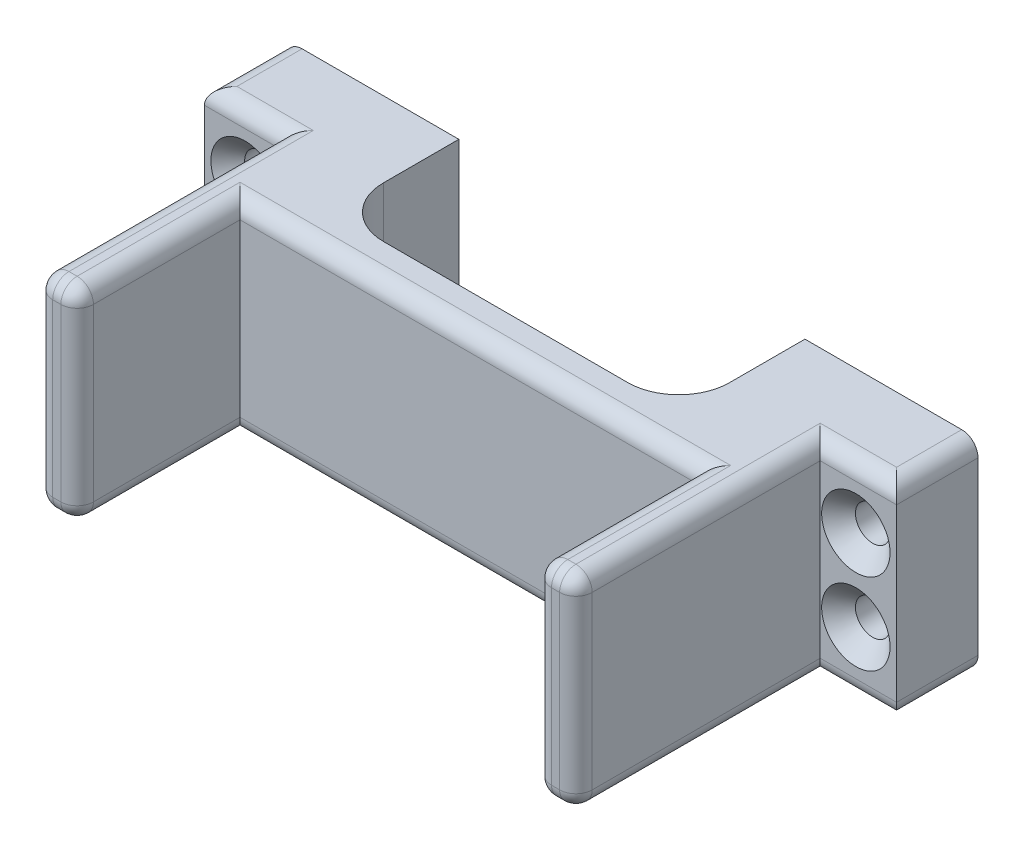
from build123d import *

# Parameters (mm, degrees)
ESBO_O1_W                                           = 68
ESBO_O1_H                                           = 20
RESSALTO_EXTRUS_O1_DEPTH                            = 8
ESCAREADO_PARA_PARAFUSO_ALLEN_SEXTAVADO_D           = 3.4
ESCAREADO_PARA_PARAFUSO_ALLEN_SEXTAVADO_CSINK_D     = 6.72
ESCAREADO_PARA_PARAFUSO_ALLEN_SEXTAVADO_CSINK_ANGLE = 90
ESBO_O4_W                                           = 4
ESBO_O4_H                                           = 20
RESSALTO_EXTRUS_O2_DEPTH                            = 24
ESBO_O5_W                                           = 45
ESBO_O5_H                                           = 20
RESSALTO_EXTRUS_O3_DEPTH                            = 8
FILETE1_R                                           = 1.6
CORTE_EXTRUS_O1_DEPTH                               = 78.768888381


with BuildPart() as part:
    # Esboço1 → Ressalto-extrusão1 (new body)
    with BuildSketch(Plane.XY):
        with Locations((34, 10)):
            Rectangle(ESBO_O1_W, ESBO_O1_H)
    extrude(amount=RESSALTO_EXTRUS_O1_DEPTH)

    # Escareado para parafuso Allen sextavado escareado de M31 (through all)
    with Locations(Plane(origin=(4, 14, 8), x_dir=(1, 0, 0), z_dir=(0, 0, 1))):
        with Locations((0, 0), (0, -8), (60, 0), (60, -8)):
            CounterSinkHole(ESCAREADO_PARA_PARAFUSO_ALLEN_SEXTAVADO_D / 2, ESCAREADO_PARA_PARAFUSO_ALLEN_SEXTAVADO_CSINK_D / 2, counter_sink_angle=ESCAREADO_PARA_PARAFUSO_ALLEN_SEXTAVADO_CSINK_ANGLE)

    # Esboço4 → Ressalto-extrusão2 (add)
    with BuildSketch(Plane.XY.offset(8)):
        with Locations((9.5, 10)):
            Rectangle(ESBO_O4_W, ESBO_O4_H)
        with Locations((58.5, 10)):
            Rectangle(ESBO_O4_W, ESBO_O4_H)
    extrude(amount=RESSALTO_EXTRUS_O2_DEPTH)

    # Esboço5 → Ressalto-extrusão3 (add)
    with BuildSketch(Plane.XY.offset(8)):
        with Locations((34, 10)):
            Rectangle(ESBO_O5_W, ESBO_O5_H)
    extrude(amount=RESSALTO_EXTRUS_O3_DEPTH)

    # Filete1
    filete1_edges = [part.edges().sort_by_distance(p)[0] for p in [
        (64.25, 20, 8),
        (64.25, 0, 8),
        (60.5, 20, 20),
        (56.5, 20, 24),
        (56.5, 0, 24),
        (60.5, 0, 20),
        (58.5, 20, 32),
        (56.5, 10, 32),
        (58.5, 0, 32),
        (60.5, 10, 32),
        (3.75, 20, 8),
        (11.5, 20, 24),
        (7.5, 20, 20),
        (7.5, 0, 20),
        (11.5, 0, 24),
        (9.5, 20, 32),
        (7.5, 10, 32),
        (9.5, 0, 32),
        (11.5, 10, 32),
        (34, 20, 16),
        (34, 0, 16),
        (0, 20, 4),
        (68, 20, 4),
        (68, 0, 4),
        (0, 0, 4),
        (3.75, 0, 8),
    ]]
    fillet(filete1_edges, radius=FILETE1_R)

    # Esboço6 → Corte-extrusão1 (cut, through all)
    with BuildSketch(Plane.XZ):
        with BuildLine():
            Line((17, 6.4), (17, 7.4))
            ThreePointArc((17, 7.4), (18.464466094, 10.935533906), (22, 12.4))
            Line((22, 12.4), (46, 12.4))
            ThreePointArc((46, 12.4), (49.535533906, 10.935533906), (51, 7.4))
            Line((51, 7.4), (51, 6.4))
            Line((51, 6.4), (51, 0))
            Line((51, 0), (17, 0))
            Line((17, 0), (17, 6.4))
        make_face()
    extrude(amount=-CORTE_EXTRUS_O1_DEPTH, mode=Mode.SUBTRACT)


solid = part.part
